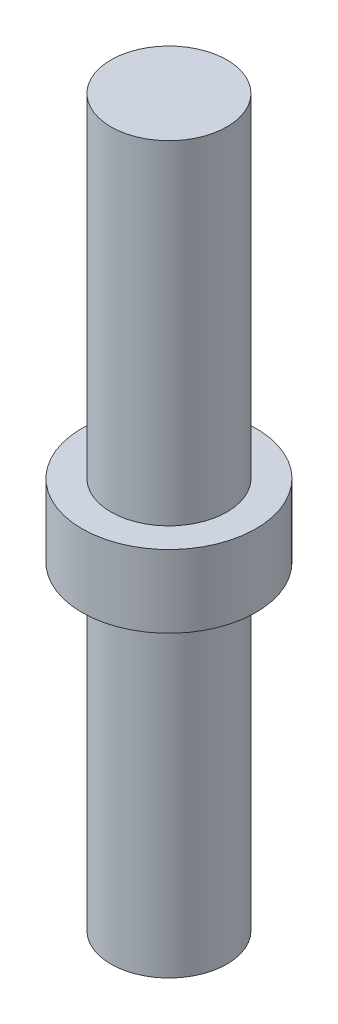
from build123d import *

# Parameters (mm, degrees)
SKETCH1_R           = 4
BOSS_EXTRUDE1_DEPTH = 50
BOSS_EXTRUDE2_START = -23
SKETCH2_R           = 6
BOSS_EXTRUDE2_DEPTH = 5


with BuildPart() as part:
    # Sketch1 → Boss-Extrude1 (new body)
    with BuildSketch(Plane(origin=(0, 0, 0), x_dir=(1, 0, 0), z_dir=(0, 1, 0))):
        with Locations(Location((0, 0, 0), (0, 0, 270))):
            Circle(SKETCH1_R)
    extrude(amount=BOSS_EXTRUDE1_DEPTH)

    # Sketch2 → Boss-Extrude2 (add)
    with BuildSketch(Plane(origin=(0, 50, 0), x_dir=(1, 0, 0), z_dir=(0, 1, 0)).offset(BOSS_EXTRUDE2_START)):
        with Locations(Location((0, 0, 0), (0, 0, 270))):
            Circle(SKETCH2_R)
    extrude(amount=-BOSS_EXTRUDE2_DEPTH)


solid = part.part
